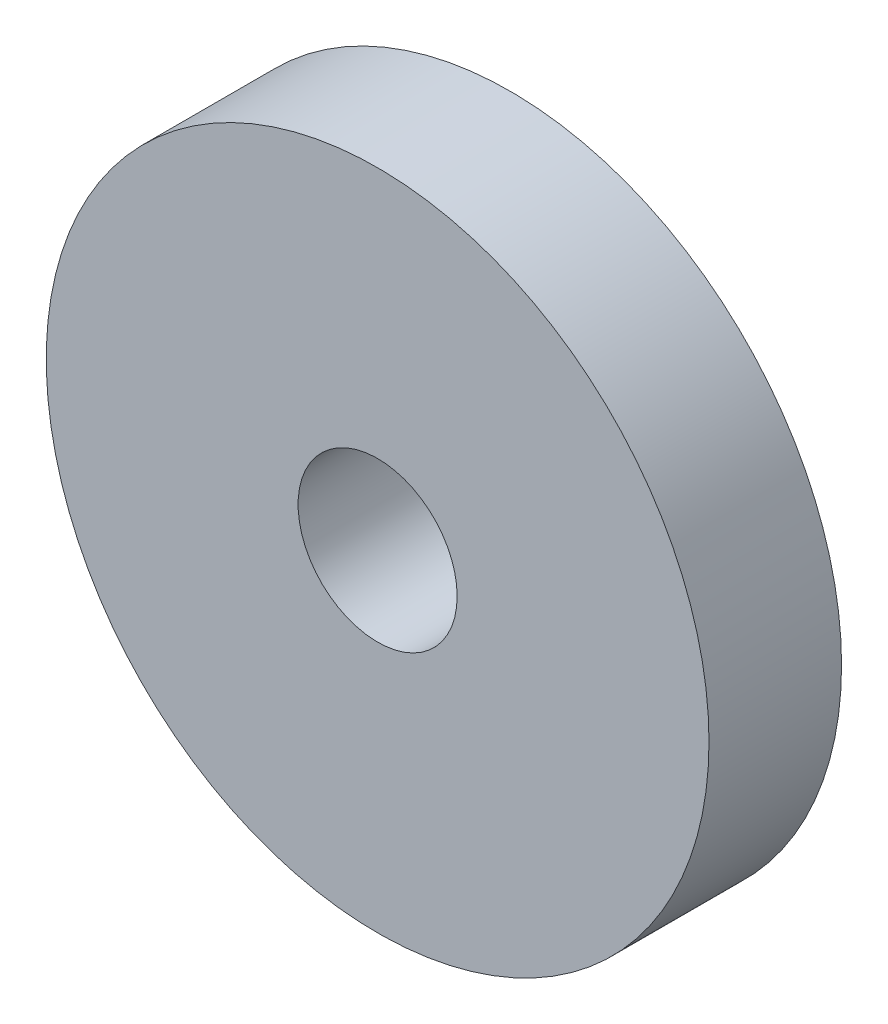
from build123d import *

# Parameters (mm, degrees)
SKETCH1_R           = 12.5
SKETCH1_R_2         = 3
BOSS_EXTRUDE1_DEPTH = 5


with BuildPart() as part:
    # Sketch1 → Boss-Extrude1 (new body)
    with BuildSketch(Plane.XY):
        Circle(SKETCH1_R)
        Circle(SKETCH1_R_2, mode=Mode.SUBTRACT)
    extrude(amount=BOSS_EXTRUDE1_DEPTH)


solid = part.part
